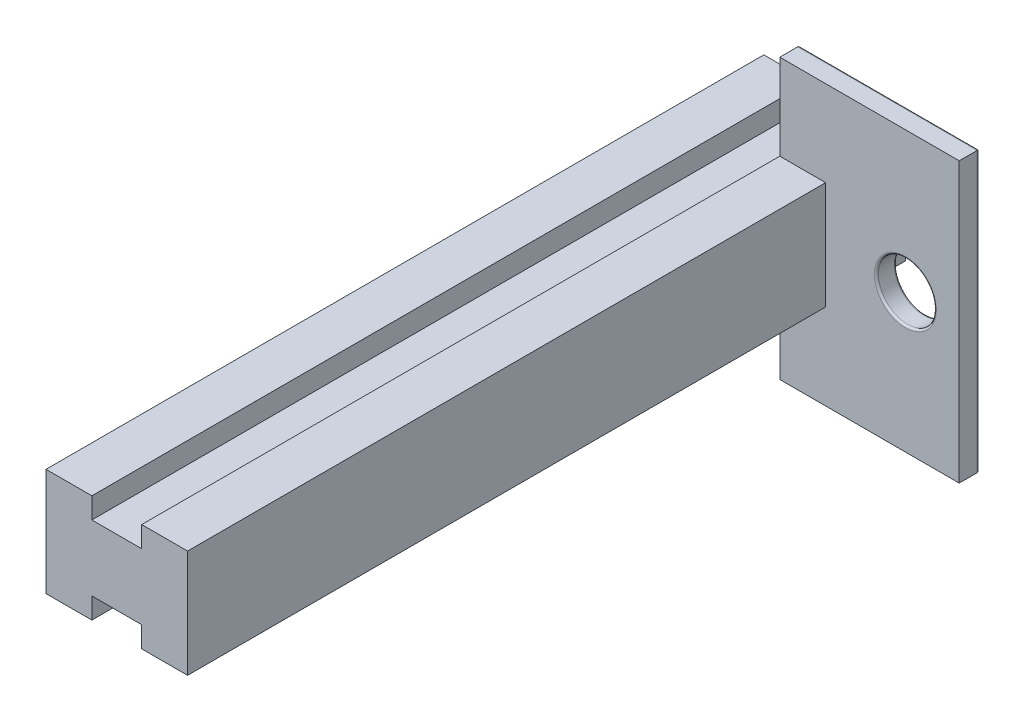
from build123d import *

# Parameters (mm, degrees)
BOSS_EXTRUDE1_DEPTH = 60
SKETCH2_W           = 2.3
SKETCH2_H           = 1
CUT_EXTRUDE1_DEPTH  = 10
SKETCH3_W           = 1
SKETCH3_H           = 14
BOSS_EXTRUDE2_DEPTH = 9
SKETCH4_R           = 1.45
CUT_EXTRUDE2_DEPTH  = 9
FILLET1_R           = 0.1
SKETCH5_W           = 7.1
SKETCH5_H           = 5.4
CUT_EXTRUDE3_DEPTH  = 24


with BuildPart() as part:
    # Sketch1 → Boss-Extrude1 (new body)
    with BuildSketch(Plane.XY):
        Polygon((-1.3, 2.75), (-3.6, 2.75), (-3.6, -2.65), (-1.3, -2.65), (-1.3, -1.6), (1.2, -1.6), (1.2, -2.65), (3.5, -2.65), (3.5, 2.75), (1.2, 2.75), (1.2, 1.7), (-1.3, 1.7), align=None)
    extrude(amount=BOSS_EXTRUDE1_DEPTH)

    # Sketch2 → Cut-Extrude1 (cut)
    with BuildSketch(Plane(origin=(0, 2.75, 0), x_dir=(1, 0, 0), z_dir=(0, 1, 0))):
        with Locations((2.35, -3.5)):
            Rectangle(SKETCH2_W, SKETCH2_H)
    extrude(amount=-CUT_EXTRUDE1_DEPTH, mode=Mode.SUBTRACT)

    # Sketch3 → Boss-Extrude2 (add)
    with BuildSketch(Plane(origin=(1.2, 0, 0), x_dir=(0, 0, -1), z_dir=(1, 0, 0))):
        with Locations((-3.5, 0.05)):
            Rectangle(SKETCH3_W, SKETCH3_H)
    extrude(amount=BOSS_EXTRUDE2_DEPTH)

    # Sketch4 → Cut-Extrude2 (cut)
    with BuildSketch(Plane(origin=(0, 0, 3), x_dir=(-1, 0, 0), z_dir=(0, 0, -1))):
        with Locations((-7.5, 0)):
            Circle(SKETCH4_R)
    extrude(amount=-CUT_EXTRUDE2_DEPTH, mode=Mode.SUBTRACT)

    # Fillet1
    fillet1_edges = [part.edges().sort_by_distance(p)[0] for p in [
        (1.2, 2.75, 1.5),
        (1.2, -2.65, 1.5),
        (3.5, 0.05, 3),
        (2.35, -2.65, 3),
        (2.35, 2.75, 3),
        (1.2, -4.8, 3),
        (1.2, 4.9, 3),
        (5.7, -6.95, 3),
        (5.7, 7.05, 3),
        (10.2, 0.05, 3),
        (8.95, 0, 4),
        (8.95, 0, 3),
    ]]
    fillet(fillet1_edges, radius=FILLET1_R)

    # Sketch5 → Cut-Extrude3 (cut)
    with BuildSketch(Plane.XY.offset(60)):
        with Locations((-0.05, 0.05)):
            Rectangle(SKETCH5_W, SKETCH5_H)
    extrude(amount=-CUT_EXTRUDE3_DEPTH, mode=Mode.SUBTRACT)


solid = part.part
